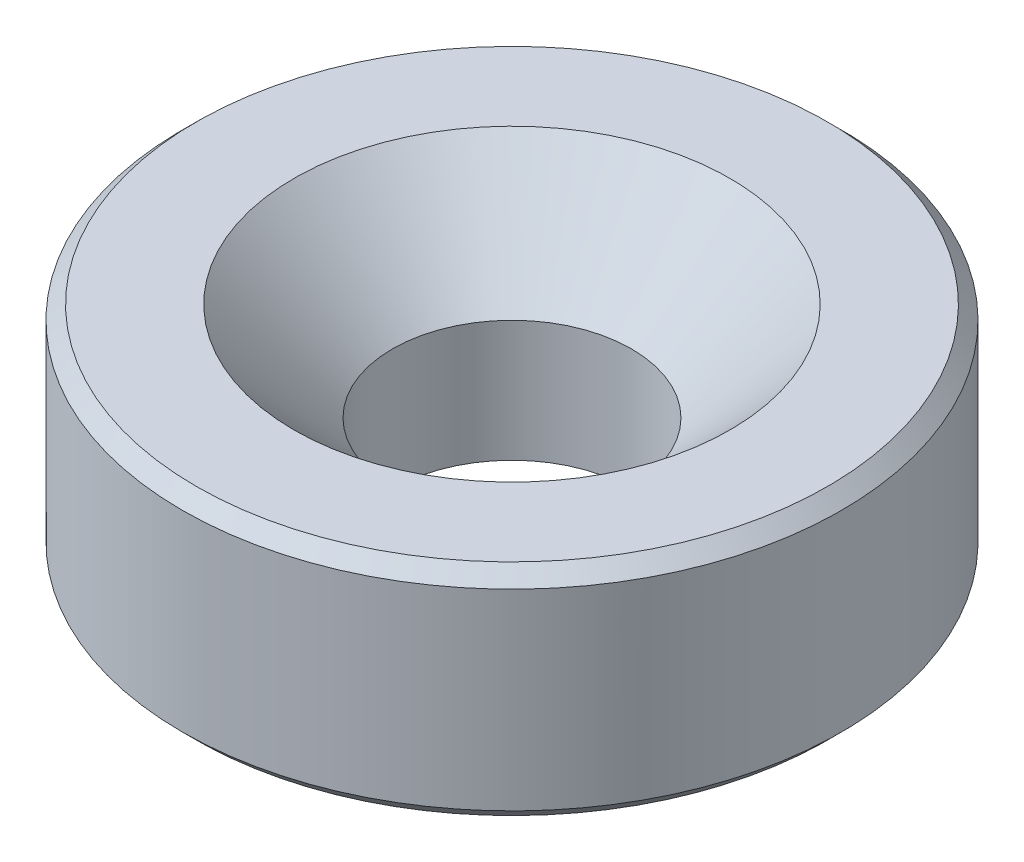
from build123d import *

# Parameters (mm, degrees)
CHAMFER1_SIZE = 0.2


with BuildPart() as part:
    # Sketch1 → Revolve1 (revolve)
    with BuildSketch(Plane.XY, mode=Mode.PRIVATE) as revolve1_sk:
        Polygon((-1.7272, 0), (-1.7272, 1.7522), (-3.15, 3.175), (-4.7625, 3.175), (-4.7625, 0), align=None)
    revolve(revolve1_sk.sketch.rotate(Axis((0, 0, 0), (0, -1, 0)), 270), axis=Axis((0, 0, 0), (0, -1, 0)))

    # Chamfer1
    chamfer1_edges = [part.edges().sort_by_distance(p)[0] for p in [
        (0, 0, -4.7625),
        (0, 3.175, -4.7625),
    ]]
    chamfer(chamfer1_edges, length=CHAMFER1_SIZE)


solid = part.part
